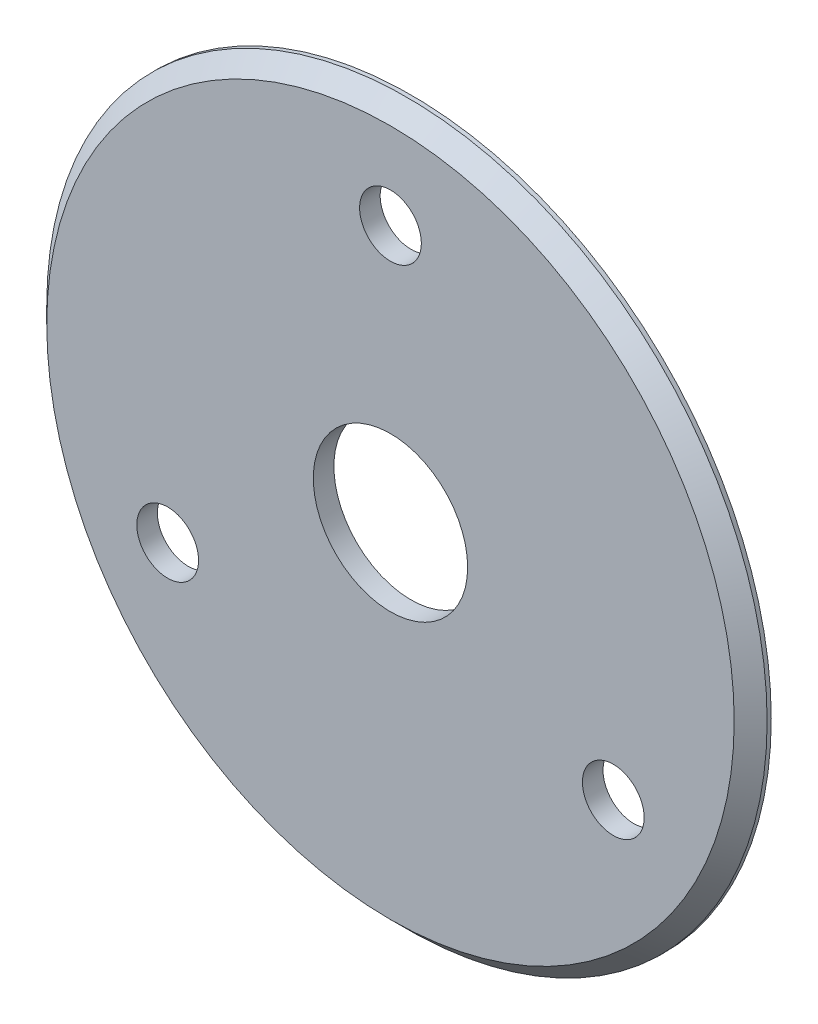
from build123d import *

# Parameters (mm, degrees)
SKETCH1_R           = 35
SKETCH1_R_2         = 7.5
SKETCH1_R_3         = 3
BOSS_EXTRUDE1_DEPTH = 2
CHAMFER1_SIZE       = 1.6


with BuildPart() as part:
    # Sketch1 → Boss-Extrude1 (new body)
    with BuildSketch(Plane.XY):
        Circle(SKETCH1_R)
        Circle(SKETCH1_R_2, mode=Mode.SUBTRACT)
        with Locations((0, 25)):
            Circle(SKETCH1_R_3, mode=Mode.SUBTRACT)
        with Locations((21.650635095, -12.5)):
            Circle(SKETCH1_R_3, mode=Mode.SUBTRACT)
        with Locations((-21.650635095, -12.5)):
            Circle(SKETCH1_R_3, mode=Mode.SUBTRACT)
    extrude(amount=BOSS_EXTRUDE1_DEPTH)

    # Chamfer1
    chamfer1_edges = [part.edges().sort_by_distance(p)[0] for p in [
        (-35, 0, 2),
    ]]
    chamfer(chamfer1_edges, length=CHAMFER1_SIZE)


solid = part.part
